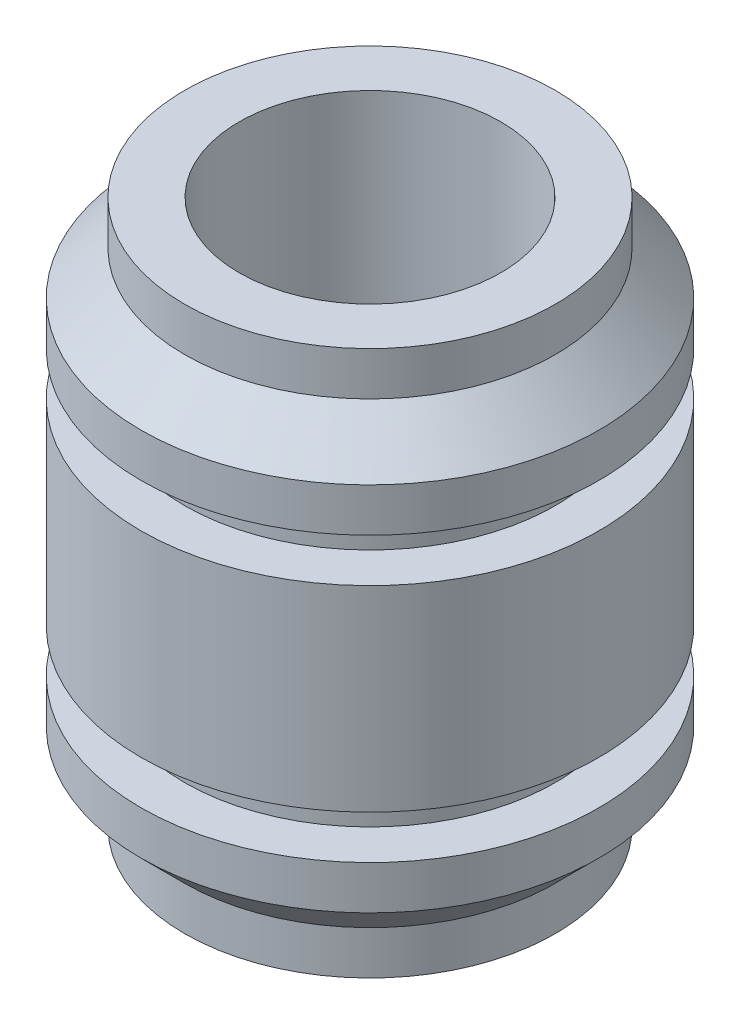
from build123d import *

# Parameters (mm, degrees)
SKETCH1_R           = 1.05
SKETCH1_R_2         = 0.6
BOSS_EXTRUDE1_DEPTH = 2.5
SKETCH2_W           = 0.2
SKETCH2_H           = 0.2


with BuildPart() as part:
    # Sketch1 → Boss-Extrude1 (new body)
    with BuildSketch(Plane(origin=(0, 0, 0), x_dir=(1, 0, 0), z_dir=(0, 1, 0))):
        with Locations(Location((0, 0, 0), (0, 0, 270))):
            Circle(SKETCH1_R)
        with Locations(Location((0, 0, 0), (0, 0, 270))):
            Circle(SKETCH1_R_2, mode=Mode.SUBTRACT)
    extrude(amount=BOSS_EXTRUDE1_DEPTH)

    # Sketch2 → Cut-Revolve1 (revolve, cut)
    with BuildSketch(Plane(origin=(0, 0, 0), x_dir=(0, 0, -1), z_dir=(1, 0, 0)), mode=Mode.PRIVATE) as cut_revolve1_sk:
        with Locations((-0.95, 1.8)):
            Rectangle(SKETCH2_W, SKETCH2_H)
        Polygon((-1.05, 2.5), (-0.85, 2.5), (-0.85, 2.3), (-1.05, 2.1), align=None)
        with Locations((-0.95, 0.7)):
            Rectangle(SKETCH2_W, SKETCH2_H)
        Polygon((-1.05, 0.4), (-0.85, 0.2), (-0.85, 0), (-1.05, 0), align=None)
    revolve(cut_revolve1_sk.sketch.rotate(Axis((0, 0, 0), (0, 1, 0)), 180), axis=Axis((0, 0, 0), (0, 1, 0)), mode=Mode.SUBTRACT)


solid = part.part
